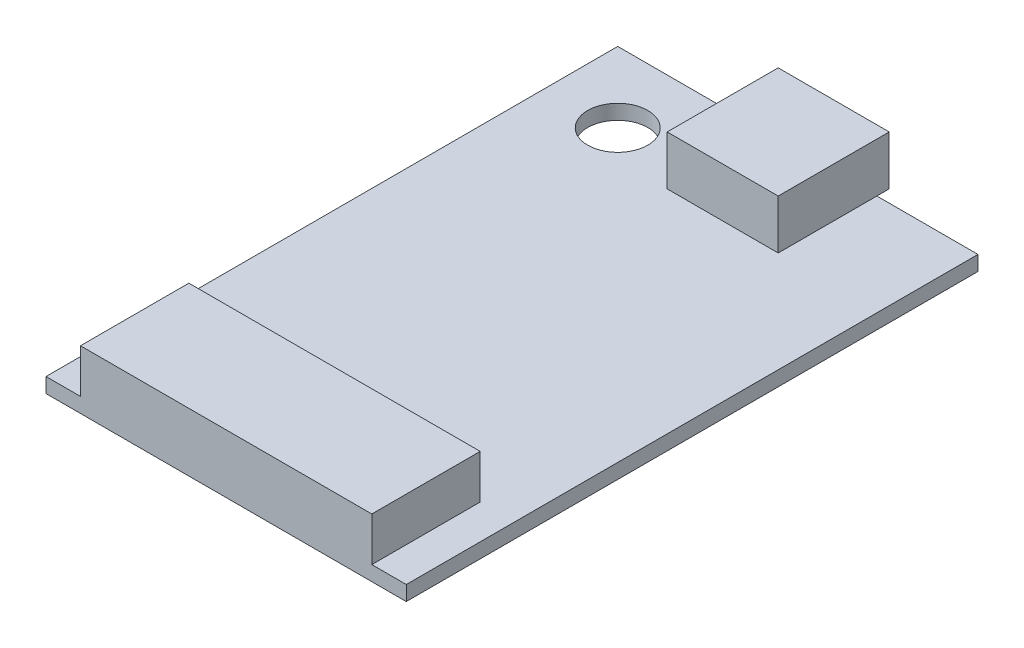
from build123d import *

# Parameters (mm, degrees)
SKETCH1_W           = 14.605
SKETCH1_H           = 23.1775
BOSS_EXTRUDE1_DEPTH = 0.6
SKETCH2_R           = 1.2192
CUT_EXTRUDE1_DEPTH  = 14.710785273
SKETCH3_W           = 11.811
SKETCH3_H           = 4.3942
BOSS_EXTRUDE2_DEPTH = 1.778
SKETCH4_W           = 4.5
SKETCH4_H           = 4.5
BOSS_EXTRUDE3_DEPTH = 2


with BuildPart() as part:
    # Sketch1 → Boss-Extrude1 (new body)
    with BuildSketch(Plane(origin=(0, 0, 0), x_dir=(1, 0, 0), z_dir=(0, 1, 0))):
        Rectangle(SKETCH1_W, SKETCH1_H)
    extrude(amount=BOSS_EXTRUDE1_DEPTH)

    # Sketch2 → Cut-Extrude1 (cut, through all)
    with BuildSketch(Plane(origin=(0, 0.6, 0), x_dir=(1, 0, 0), z_dir=(0, 1, 0))):
        with Locations(Location((-4.445, 8.73125, 0), (0, 0, 270))):
            Circle(SKETCH2_R)
    extrude(amount=-CUT_EXTRUDE1_DEPTH, mode=Mode.SUBTRACT)

    # Sketch3 → Boss-Extrude2 (add)
    with BuildSketch(Plane(origin=(0, 0.6, 0.6), x_dir=(1, 0, 0), z_dir=(0, 1, 0))):
        with Locations((0, -8.79165)):
            Rectangle(SKETCH3_W, SKETCH3_H)
    extrude(amount=BOSS_EXTRUDE2_DEPTH)

    # Sketch4 → Boss-Extrude3 (add)
    with BuildSketch(Plane(origin=(0, 0.6, 0), x_dir=(1, 0, 0), z_dir=(0, 1, 0))):
        with Locations((0.9525, 9.83875)):
            Rectangle(SKETCH4_W, SKETCH4_H)
    extrude(amount=BOSS_EXTRUDE3_DEPTH)


solid = part.part
